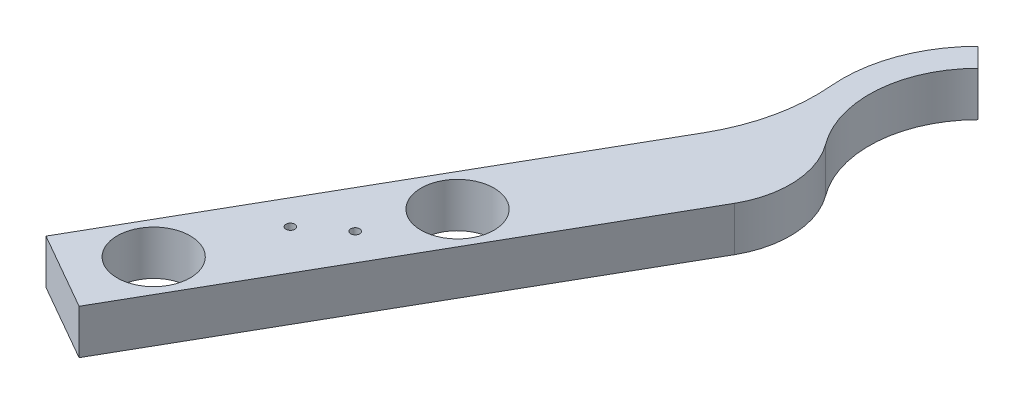
from build123d import *

# Parameters (mm, degrees)
SKETCH_2_R          = 4.1
EXTRUDE_1_DEPTH     = 5
FILLET_1_R          = 20
SKETCH_6_R          = 0.5
CUT_EXTRUDE_3_DEPTH = 51.047278583
FILLET_2_R          = 10


with BuildPart() as part:
    # ｽｹｯﾁ2 → ﾎﾞｽ - 押し出し1 (new body)
    with BuildSketch(Plane(origin=(0, 0, 0), x_dir=(1, 0, 0), z_dir=(0, 1, 0))):
        with BuildLine():
            Line((10.525449769, 28.464000424), (-20.21962407, -25.270887679))
            Line((-20.21962407, -25.270887679), (-11.539937113, -30.237076794))
            Line((-11.539937113, -30.237076794), (19.283832312, 23.635351995))
            ThreePointArc((19.283832312, 23.635351995), (12.394035574, 32.590650485), (15.787121591, 43.368110179))
            Line((15.787121591, 43.368110179), (13.648123578, 45.507108192))
            ThreePointArc((13.648123578, 45.507108192), (9.431206098, 37.472115328), (10.525449769, 28.464000424))
        make_face()
        with Locations(Location((-12.155138755, -21.244217019, 0), (0, 0, 270))):
            Circle(SKETCH_2_R, mode=Mode.SUBTRACT)
        with Locations(Location((0.260334032, 0.455000374, 0), (0, 0, 270))):
            Circle(SKETCH_2_R, mode=Mode.SUBTRACT)
    extrude(amount=EXTRUDE_1_DEPTH)

    # ﾌｨﾚｯﾄ1
    fillet_1_edges = [part.edges().sort_by_distance(p)[0] for p in [
        (10.525449769, 2.5, -28.464000424),
    ]]
    fillet(fillet_1_edges, radius=FILLET_1_R)

    # ｽｹｯﾁ6 → ｶｯﾄ - 押し出し3 (cut, through all)
    with BuildSketch(Plane(origin=(0, 5, 0), x_dir=(1, 0, 0), z_dir=(0, 1, 0))):
        with Locations(Location((-7.408738509, -10.639307665, 0), (0, 0, 270))):
            Circle(SKETCH_6_R)
        with Locations(Location((-3.329499593, -7.444424173, 0), (0, 0, 270))):
            Circle(SKETCH_6_R)
    extrude(amount=-CUT_EXTRUDE_3_DEPTH, mode=Mode.SUBTRACT)

    # ﾌｨﾚｯﾄ2
    fillet_2_edges = [part.edges().sort_by_distance(p)[0] for p in [
        (19.283832312, 2.5, -23.635351995),
    ]]
    fillet(fillet_2_edges, radius=FILLET_2_R)


solid = part.part
